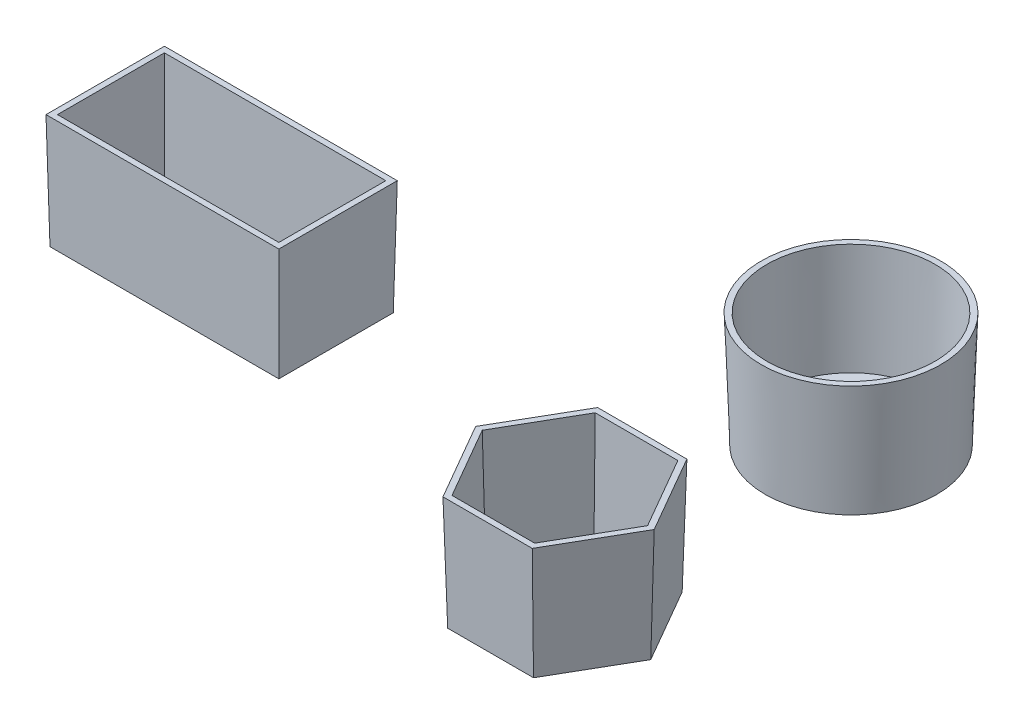
from build123d import *

# Parameters (mm, degrees)
CROQUIS1_W              = 40
CROQUIS1_H              = 20
SALIENTE_EXTRUIR1_DEPTH = 20
SALIENTE_EXTRUIR1_DRAFT = -1
CROQUIS1_3_R            = 15
SALIENTE_EXTRUIR2_DEPTH = 20
SALIENTE_EXTRUIR2_DRAFT = -2
SALIENTE_EXTRUIR3_DEPTH = 20
SALIENTE_EXTRUIR3_DRAFT = -1.5
VACIADO1_T              = -1
VACIADO2_T              = -1
VACIADO3_T              = -1


with BuildPart() as part:
    # Croquis1 → Saliente-Extruir1 (with draft: the straight prism first)
    with BuildSketch(Plane(origin=(0, 0, 0), x_dir=(1, 0, 0), z_dir=(0, 1, 0))):
        with Locations((-45, 0)):
            Rectangle(CROQUIS1_W, CROQUIS1_H)
    extrude(amount=SALIENTE_EXTRUIR1_DEPTH)
    # Saliente-Extruir1: the draft: its side faces are tilted about the plane it starts from
    saliente_extruir1_sides = [part.faces().sort_by_distance(p)[0] for p in [
        (-65, 10, 0),
        (-45, 10, 10),
        (-25, 10, 0),
        (-45, 10, -10),
    ]]
    draft(saliente_extruir1_sides, Plane(origin=(0, 0, 0), x_dir=(1, 0, 0), z_dir=(0, 1, 0)), SALIENTE_EXTRUIR1_DRAFT)

    # Vaciado1
    vaciado1_openings = [part.faces().sort_by_distance(p)[0] for p in [
        (-45, 20, 0),
    ]]
    offset(amount=VACIADO1_T, openings=vaciado1_openings, kind=Kind.INTERSECTION)


with BuildPart() as body_2:
    # Croquis1<3> → Saliente-Extruir2 (with draft: the straight prism first)
    with BuildSketch(Plane(origin=(0, 0, 0), x_dir=(1, 0, 0), z_dir=(0, 1, 0))):
        with Locations((35, 30)):
            Circle(CROQUIS1_3_R)
    extrude(amount=SALIENTE_EXTRUIR2_DEPTH)
    # Saliente-Extruir2: the draft: its side faces are tilted about the plane it starts from
    saliente_extruir2_sides = [body_2.faces().sort_by_distance(p)[0] for p in [
        (20, 10, -30),
    ]]
    draft(saliente_extruir2_sides, Plane(origin=(0, 0, 0), x_dir=(1, 0, 0), z_dir=(0, 1, 0)), SALIENTE_EXTRUIR2_DRAFT)

    # Vaciado3
    vaciado3_openings = [body_2.faces().sort_by_distance(p)[0] for p in [
        (35, 20, -30),
    ]]
    offset(amount=VACIADO3_T, openings=vaciado3_openings, kind=Kind.INTERSECTION)


with BuildPart() as body_3:
    # Croquis1<4> → Saliente-Extruir3 (with draft: the straight prism first)
    with BuildSketch(Plane(origin=(0, 0, 0), x_dir=(1, 0, 0), z_dir=(0, 1, 0))):
        Polygon((42.5, -32.990381057), (50, -20), (42.5, -7.009618943), (27.5, -7.009618943), (20, -20), (27.5, -32.990381057), align=None)
    extrude(amount=SALIENTE_EXTRUIR3_DEPTH)
    # Saliente-Extruir3: the draft: its side faces are tilted about the plane it starts from
    saliente_extruir3_sides = [body_3.faces().sort_by_distance(p)[0] for p in [
        (46.25, 10, 26.495190528),
        (46.25, 10, 13.504809472),
        (35, 10, 7.009618943),
        (23.75, 10, 13.504809472),
        (23.75, 10, 26.495190528),
        (35, 10, 32.990381057),
    ]]
    draft(saliente_extruir3_sides, Plane(origin=(0, 0, 0), x_dir=(1, 0, 0), z_dir=(0, 1, 0)), SALIENTE_EXTRUIR3_DRAFT)

    # Vaciado2
    vaciado2_openings = [body_3.faces().sort_by_distance(p)[0] for p in [
        (35, 20, 20),
    ]]
    offset(amount=VACIADO2_T, openings=vaciado2_openings, kind=Kind.INTERSECTION)


solid = Compound([part.part, body_2.part, body_3.part])
